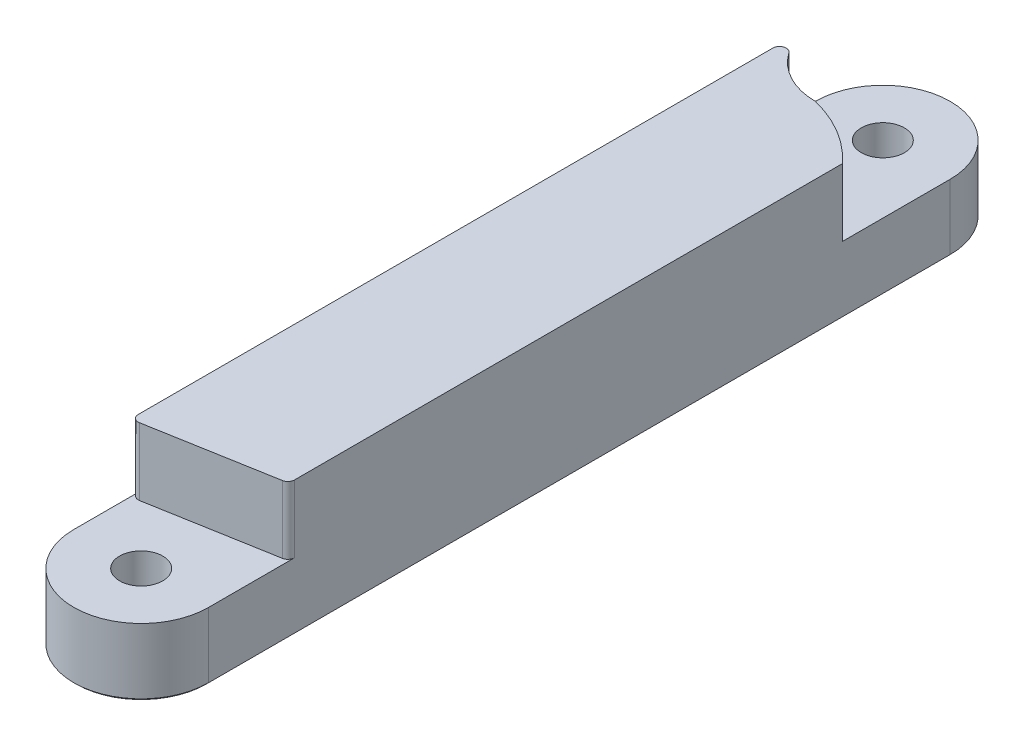
from build123d import *

# Parameters (mm, degrees)
CENTER_BODY_DEPTH               = 10
SKETCH1_3_R                     = 1.6
SKETCH1_3_R_2                   = 1.6000000000000003
CONNECTOR_BODY_DEPTH            = 5
MECH_LOCK_RIGHT_DEPTH           = 5
DULLING_FILLET_GENERAL_R        = 0.5
ELEPHANTSFOOT_COMPENSATION_SIZE = 0.16
DULLING_FILLET_RIGHT_R          = 0.5


with BuildPart() as part:
    # complete_sketch → center_body (new body)
    with BuildSketch(Plane(origin=(0, 0, 0), x_dir=(1, 0, 0), z_dir=(0, 1, 0))):
        Polygon((-5, 47), (-5, 4.195498155886381), (5, 5.958767962971076), (5, 47), align=None)
    extrude(amount=CENTER_BODY_DEPTH)

    # Sketch1<3> → connector_body (add)
    # profile 1 of 2: a face of its own
    with BuildSketch(Plane(origin=(0, 0, 0), x_dir=(1, 0, 0), z_dir=(0, 1, 0))):
        with BuildLine():
            Line((-5, 4.195498155886381), (-5, 0))
            ThreePointArc((-5, 0), (-3.1e-16, -5), (5, -6.1e-16))
            Line((5, 0), (5, 5.958767962971076))
            Line((5, 5.958767962971076), (-5, 4.195498155886381))
        make_face()
        Circle(SKETCH1_3_R, mode=Mode.SUBTRACT)
    # profile 2 of 2: a face of its own
    with BuildSketch(Plane(origin=(0, 0, 0), x_dir=(1, 0, 0), z_dir=(0, 1, 0))):
        with BuildLine():
            Line((-5, 55), (-5, 47))
            Line((-5, 47), (5, 47))
            Line((5.000000000000001, 47), (5, 55))
            ThreePointArc((5, 55), (-1.4e-16, 60), (-5, 55))
        make_face()
        with Locations((0, 55)):
            Circle(SKETCH1_3_R_2, mode=Mode.SUBTRACT)
    extrude(amount=CONNECTOR_BODY_DEPTH)

    # Sketch2 → mech_lock_right (add)
    with BuildSketch(Plane(origin=(0, 5, 0), x_dir=(1, 0, 0), z_dir=(0, 1, 0))):
        with BuildLine():
            Line((5, 47), (-5, 47))
            Line((-5, 47), (-5, 55))
            ThreePointArc((-5, 55), (-3.5355339059327315, 51.46446609406727), (0, 50))
            ThreePointArc((0, 50), (2.7235158716690253, 48.87252645278171), (5, 47))
        make_face()
    extrude(amount=MECH_LOCK_RIGHT_DEPTH)

    # dulling_fillet_general
    dulling_fillet_general_edges = [part.edges().sort_by_distance(p)[0] for p in [
        (5, 7.5, -5.958767962971076),
        (-5, 7.5, -4.195498155886381),
    ]]
    fillet(dulling_fillet_general_edges, radius=DULLING_FILLET_GENERAL_R)

    # elephantsfoot_compensation
    elephantsfoot_compensation_edges = [part.edges().sort_by_distance(p)[0] for p in [
        (-1.6000000000000003, 0, -55),
        (-1.6, 0, -2e-16),
        (1.4e-16, 0, 5),
        (-1.4e-16, 0, -60),
        (5, 0, -27.5),
        (-5, 0, -27.5),
    ]]
    chamfer(elephantsfoot_compensation_edges, length=ELEPHANTSFOOT_COMPENSATION_SIZE)

    # dulling_fillet_right
    dulling_fillet_right_edges = [part.edges().sort_by_distance(p)[0] for p in [
        (-4.999999999999998, 7.5, -55),
    ]]
    fillet(dulling_fillet_right_edges, radius=DULLING_FILLET_RIGHT_R)


solid = part.part
